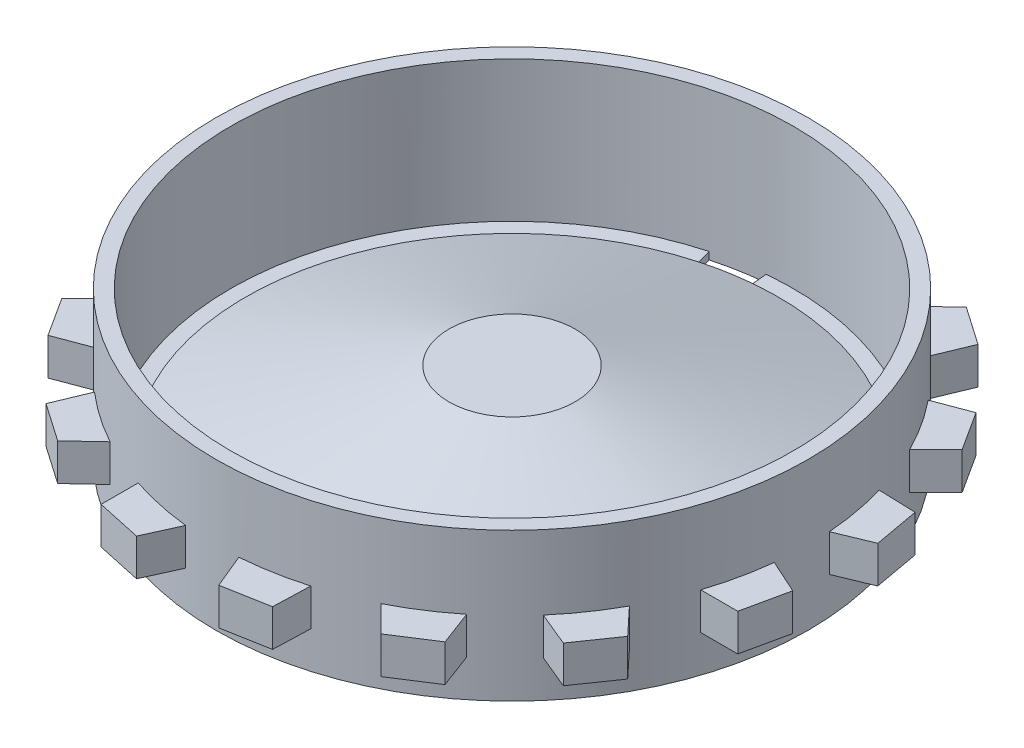
from build123d import *

# Parameters (mm, degrees)
SKETCH1_R           = 40
BOSS_EXTRUDE1_DEPTH = 10
SKETCH2_R           = 38
CUT_EXTRUDE1_DEPTH  = 9
CUT_EXTRUDE2_DEPTH  = 8
SKETCH4_R           = 36
BOSS_EXTRUDE2_DEPTH = 10
BOSS_EXTRUDE2_TAPER = 70
SKETCH5_R           = 35
CUT_EXTRUDE3_DEPTH  = 10
CUT_EXTRUDE3_DRAFT  = -70
BOSS_EXTRUDE4_START = -5
BOSS_EXTRUDE4_DEPTH = 5
BOSS_EXTRUDE5_START = 10
SKETCH8_R           = 40
SKETCH8_R_2         = 38
BOSS_EXTRUDE5_DEPTH = 10


with BuildPart() as part:
    # Sketch1 → Boss-Extrude1 (new body)
    with BuildSketch(Plane(origin=(0, 0, 0), x_dir=(1, 0, 0), z_dir=(0, 1, 0))):
        with Locations(Location((0, 0, 0), (0, 0, 270))):
            Circle(SKETCH1_R)
    extrude(amount=BOSS_EXTRUDE1_DEPTH)

    # Sketch2 → Cut-Extrude1 (cut)
    with BuildSketch(Plane(origin=(0, 10, 0), x_dir=(1, 0, 0), z_dir=(0, 1, 0))):
        with Locations(Location((0, 0, 0), (0, 0, 270))):
            Circle(SKETCH2_R)
    extrude(amount=-CUT_EXTRUDE1_DEPTH, mode=Mode.SUBTRACT)

    # Sketch3 → Cut-Extrude2 (cut)
    with BuildSketch(Plane(origin=(0, 1, 0), x_dir=(1, 0, 0), z_dir=(0, 1, 0))):
        with BuildLine():
            Line((-10.01806559, 36.655672983), (-9.49079898, 34.726427036))
            ThreePointArc((-9.49079898, 34.726427036), (-6.428076084, 35.421460132), (-3.316431646, 35.846914527))
            Line((-3.316431646, 35.846914527), (-3.500677849, 37.838409779))
            ThreePointArc((-3.500677849, 37.838409779), (-6.785191422, 37.389319028), (-10.01806559, 36.655672983))
        make_face()
        with BuildLine():
            Line((10.01806559, -36.655672983), (9.49079898, -34.726427036))
            ThreePointArc((9.49079898, -34.726427036), (6.428076084, -35.421460132), (3.316431646, -35.846914527))
            Line((3.316431646, -35.846914527), (3.500677849, -37.838409779))
            ThreePointArc((3.500677849, -37.838409779), (6.785191421, -37.389319028), (10.01806559, -36.655672983))
        make_face()
    extrude(amount=-CUT_EXTRUDE2_DEPTH, mode=Mode.SUBTRACT)

    # Sketch4 → Boss-Extrude2 (add)
    with BuildSketch(Plane(origin=(0, 1, 0), x_dir=(1, 0, 0), z_dir=(0, 1, 0))):
        Circle(SKETCH4_R)
    extrude(amount=BOSS_EXTRUDE2_DEPTH, taper=BOSS_EXTRUDE2_TAPER)


with BuildPart() as cut_extrude3_tool:
    # Sketch5 → Cut-Extrude3 (with draft: the straight prism first)
    with BuildSketch(Plane.XZ):
        Circle(SKETCH5_R)
    extrude(amount=-CUT_EXTRUDE3_DEPTH)
    # Cut-Extrude3: the draft: its side faces are tilted about the plane it starts from
    cut_extrude3_sides = [cut_extrude3_tool.faces().sort_by_distance(p)[0] for p in [
        (-35, 5, 0),
    ]]
    draft(cut_extrude3_sides, Plane.XZ, CUT_EXTRUDE3_DRAFT)


with BuildPart() as part_1:
    add(part.part)

    # Cut-Extrude3: cut by cut_extrude3_tool
    add(cut_extrude3_tool.part, mode=Mode.SUBTRACT)

    # Sketch7 → Boss-Extrude4 (add)
    with BuildSketch(Plane(origin=(0, 10, 0), x_dir=(1, 0, 0), z_dir=(0, 1, 0)).offset(BOSS_EXTRUDE4_START)):
        with BuildLine():
            Line((-11.051326445, 43.40114745), (-11.217125783, 38.395000836))
            ThreePointArc((-11.217125783, 38.395000836), (-7.142306759, 39.357177924), (-2.989235129, 39.888149535))
            Line((-2.989235129, 39.888149535), (-4.90350342, 44.516817838))
            Line((-4.90350342, 44.516817838), (-11.051326445, 43.40114745))
        make_face()
        with BuildLine():
            Line((6.398805765, 44.326591353), (4.329857781, 39.764963619))
            ThreePointArc((4.329857781, 39.764963619), (8.462708906, 39.094533607), (12.502840822, 37.995775705))
            Line((12.502840822, 37.995775705), (12.505602201, 43.004666372))
            Line((12.505602201, 43.004666372), (6.398805765, 44.326591353))
        make_face()
        with BuildLine():
            Line((22.874777803, 38.503713544), (19.217659748, 35.081071161))
            ThreePointArc((19.217659748, 35.081071161), (22.779353856, 32.880100941), (26.091472595, 30.318889455))
            Line((26.091472595, 30.318889455), (28.01084325, 34.94544429))
            Line((28.01084325, 34.94544429), (22.874777803, 38.503713544))
        make_face()
        with BuildLine():
            Line((35.868272281, 26.818994385), (31.179747227, 25.05640363))
            ThreePointArc((31.179747227, 25.05640363), (33.628048676, 21.659970966), (35.707914186, 18.026227128))
            Line((35.707914186, 18.026227128), (39.251687333, 21.566095096))
            Line((39.251687333, 21.566095096), (35.868272281, 26.818994385))
        make_face()
        with BuildLine():
            Line((43.40114745, 11.051326445), (38.395000836, 11.217125783))
            ThreePointArc((38.395000836, 11.217125783), (39.357177924, 7.142306759), (39.888149535, 2.989235129))
            Line((39.888149535, 2.989235129), (44.516817838, 4.90350342))
            Line((44.516817838, 4.90350342), (43.40114745, 11.051326445))
        make_face()
        with BuildLine():
            Line((44.326591353, -6.398805765), (39.764963619, -4.329857781))
            ThreePointArc((39.764963619, -4.329857781), (39.094533607, -8.462708906), (37.995775705, -12.502840822))
            Line((37.995775705, -12.502840822), (43.004666372, -12.505602201))
            Line((43.004666372, -12.505602201), (44.326591353, -6.398805765))
        make_face()
        with BuildLine():
            Line((38.503713544, -22.874777803), (35.081071161, -19.217659748))
            ThreePointArc((35.081071161, -19.217659748), (32.880100941, -22.779353856), (30.318889455, -26.091472595))
            Line((30.318889455, -26.091472595), (34.94544429, -28.01084325))
            Line((34.94544429, -28.01084325), (38.503713544, -22.874777803))
        make_face()
        with BuildLine():
            Line((26.818994385, -35.868272281), (25.05640363, -31.179747227))
            ThreePointArc((25.05640363, -31.179747227), (21.659970966, -33.628048676), (18.026227128, -35.707914186))
            Line((18.026227128, -35.707914186), (21.566095096, -39.251687333))
            Line((21.566095096, -39.251687333), (26.818994385, -35.868272281))
        make_face()
        with BuildLine():
            Line((11.051326445, -43.40114745), (11.217125783, -38.395000836))
            ThreePointArc((11.217125783, -38.395000836), (7.142306759, -39.357177924), (2.989235129, -39.888149535))
            Line((2.989235129, -39.888149535), (4.90350342, -44.516817838))
            Line((4.90350342, -44.516817838), (11.051326445, -43.40114745))
        make_face()
        with BuildLine():
            Line((-6.398805765, -44.326591353), (-4.329857781, -39.764963619))
            ThreePointArc((-4.329857781, -39.764963619), (-8.462708906, -39.094533607), (-12.502840822, -37.995775705))
            Line((-12.502840822, -37.995775705), (-12.505602201, -43.004666372))
            Line((-12.505602201, -43.004666372), (-6.398805765, -44.326591353))
        make_face()
        with BuildLine():
            Line((-22.874777803, -38.503713544), (-19.217659748, -35.081071161))
            ThreePointArc((-19.217659748, -35.081071161), (-22.779353856, -32.880100941), (-26.091472595, -30.318889455))
            Line((-26.091472595, -30.318889455), (-28.01084325, -34.94544429))
            Line((-28.01084325, -34.94544429), (-22.874777803, -38.503713544))
        make_face()
        with BuildLine():
            Line((-35.868272281, -26.818994385), (-31.179747227, -25.05640363))
            ThreePointArc((-31.179747227, -25.05640363), (-33.628048676, -21.659970966), (-35.707914186, -18.026227128))
            Line((-35.707914186, -18.026227128), (-39.251687333, -21.566095096))
            Line((-39.251687333, -21.566095096), (-35.868272281, -26.818994385))
        make_face()
        with BuildLine():
            Line((-43.40114745, -11.051326445), (-38.395000836, -11.217125783))
            ThreePointArc((-38.395000836, -11.217125783), (-39.357177924, -7.142306759), (-39.888149535, -2.989235129))
            Line((-39.888149535, -2.989235129), (-44.516817838, -4.90350342))
            Line((-44.516817838, -4.90350342), (-43.40114745, -11.051326445))
        make_face()
        with BuildLine():
            Line((-44.326591353, 6.398805765), (-39.764963619, 4.329857781))
            ThreePointArc((-39.764963619, 4.329857781), (-39.094533607, 8.462708906), (-37.995775705, 12.502840822))
            Line((-37.995775705, 12.502840822), (-43.004666372, 12.505602201))
            Line((-43.004666372, 12.505602201), (-44.326591353, 6.398805765))
        make_face()
        with BuildLine():
            Line((-38.503713544, 22.874777803), (-35.081071161, 19.217659748))
            ThreePointArc((-35.081071161, 19.217659748), (-32.880100941, 22.779353856), (-30.318889455, 26.091472595))
            Line((-30.318889455, 26.091472595), (-34.94544429, 28.01084325))
            Line((-34.94544429, 28.01084325), (-38.503713544, 22.874777803))
        make_face()
        with BuildLine():
            Line((-26.818994385, 35.868272281), (-25.05640363, 31.179747227))
            ThreePointArc((-25.05640363, 31.179747227), (-21.659970966, 33.628048676), (-18.026227128, 35.707914186))
            Line((-18.026227128, 35.707914186), (-21.566095096, 39.251687333))
            Line((-21.566095096, 39.251687333), (-26.818994385, 35.868272281))
        make_face()
    extrude(amount=BOSS_EXTRUDE4_DEPTH)

    # Sketch8 → Boss-Extrude5 (add)
    with BuildSketch(Plane(origin=(0, 10, 0), x_dir=(1, 0, 0), z_dir=(0, 1, 0)).offset(BOSS_EXTRUDE5_START)):
        with Locations(Location((0, 0, 0), (0, 0, 270))):
            Circle(SKETCH8_R)
        with Locations(Location((0, 0, 0), (0, 0, 270))):
            Circle(SKETCH8_R_2, mode=Mode.SUBTRACT)
    extrude(amount=-BOSS_EXTRUDE5_DEPTH)


solid = part_1.part
